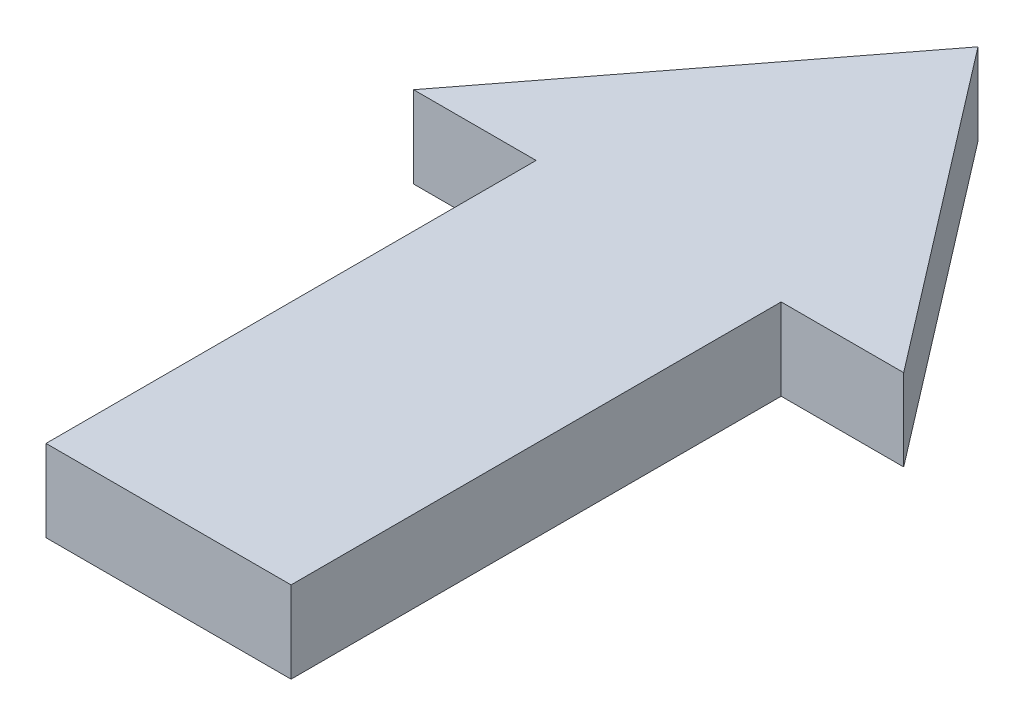
from build123d import *

# Parameters (mm, degrees)
SKETCH1_W           = 76.2
SKETCH1_H           = 152.4
BOSS_EXTRUDE1_DEPTH = 25.4


with BuildPart() as part:
    # Sketch1 → Boss-Extrude1 (new body)
    with BuildSketch(Plane(origin=(0, 0, 0), x_dir=(1, 0, 0), z_dir=(0, 1, 0))):
        Polygon((-76.2, 76.2), (76.2, 76.2), (0, 175.505773411), align=None)
        Rectangle(SKETCH1_W, SKETCH1_H)
    extrude(amount=BOSS_EXTRUDE1_DEPTH)


solid = part.part
